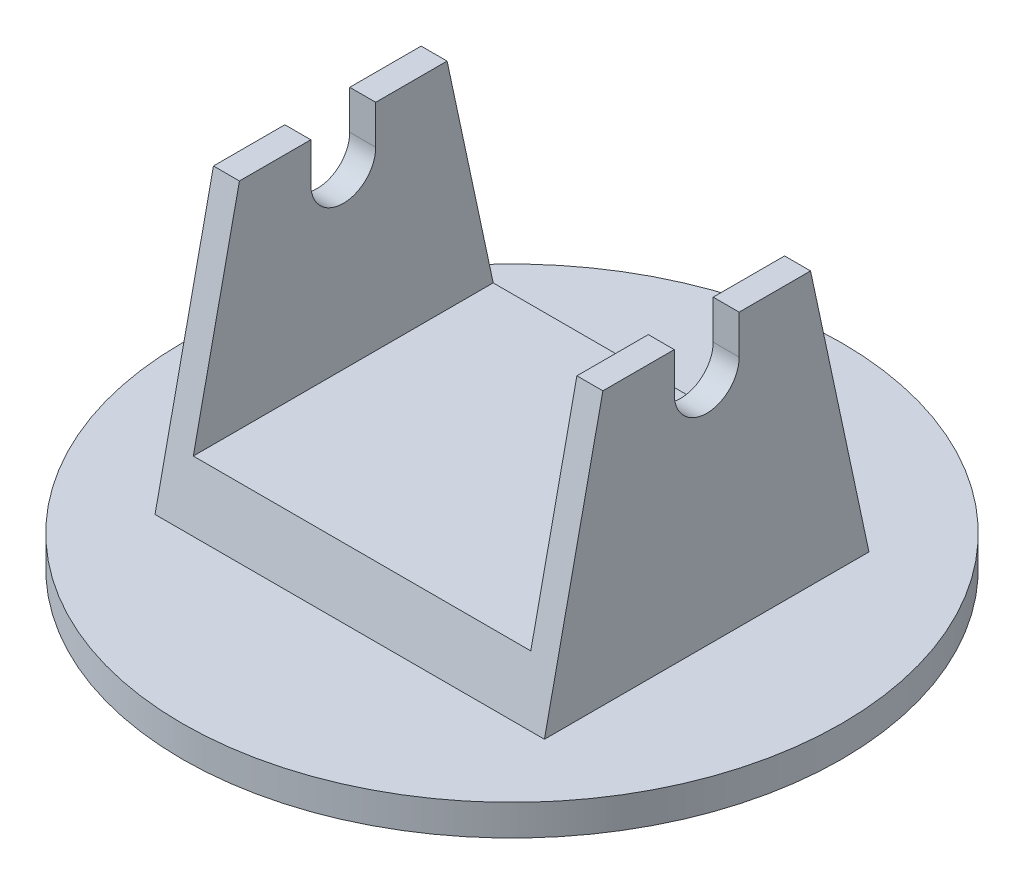
from build123d import *

# Parameters (mm, degrees)
SKETCH2_R               = 50.8
BOSS_EXTRUDE1_DEPTH     = 4.7625
BOSS_EXTRUDE2_DEPTH     = 30
CUT_EXTRUDE2_DEPTH      = 128.159272666
CUT_EXTRUDE1_DEPTH      = 111.550805628
CUT_EXTRUDE1_DEPTH_BACK = 111.550805628
SKETCH5_W               = 52
SKETCH5_H               = 33.1537


with BuildPart() as part:
    # Sketch2 → Boss-Extrude1 (new body)
    with BuildSketch(Plane(origin=(0, 37.2625, 0), x_dir=(-1, 0, 0), z_dir=(0, 1, 0))):
        with Locations(Location((0, 0, 0), (0, 0, 270))):
            Circle(SKETCH2_R)
    extrude(amount=BOSS_EXTRUDE1_DEPTH)

    # Sketch4 → Boss-Extrude2 (add, symmetric)
    with BuildSketch(Plane(origin=(0, 0, 0), x_dir=(0, 0, -1), z_dir=(1, 0, 0))):
        Polygon((-25, 42.025), (25, 42.025), (16, 84.025), (-16, 84.025), align=None)
    extrude(amount=BOSS_EXTRUDE2_DEPTH, both=True)

    # Sketch6 → Cut-Extrude2 (cut, through all)
    with BuildSketch(Plane(origin=(30, 0, 0), x_dir=(0, 0, -1), z_dir=(1, 0, 0))):
        with BuildLine():
            Line((5, 78.025), (5, 84.025))
            Line((5, 84.025), (-5, 84.025))
            Line((-5, 84.025), (-5, 78.025))
            ThreePointArc((-5, 78.025), (0, 73.025), (5, 78.025))
        make_face()
    extrude(amount=-CUT_EXTRUDE2_DEPTH, mode=Mode.SUBTRACT)

    # Sketch5 → Cut-Extrude1 (cut, two sides: drawn at the far end of the back side and taken through both)
    with BuildSketch(Plane.XY.offset(-CUT_EXTRUDE1_DEPTH_BACK)):
        with Locations((0, 67.44815)):
            Rectangle(SKETCH5_W, SKETCH5_H)
    extrude(amount=CUT_EXTRUDE1_DEPTH + CUT_EXTRUDE1_DEPTH_BACK, mode=Mode.SUBTRACT)


solid = part.part
